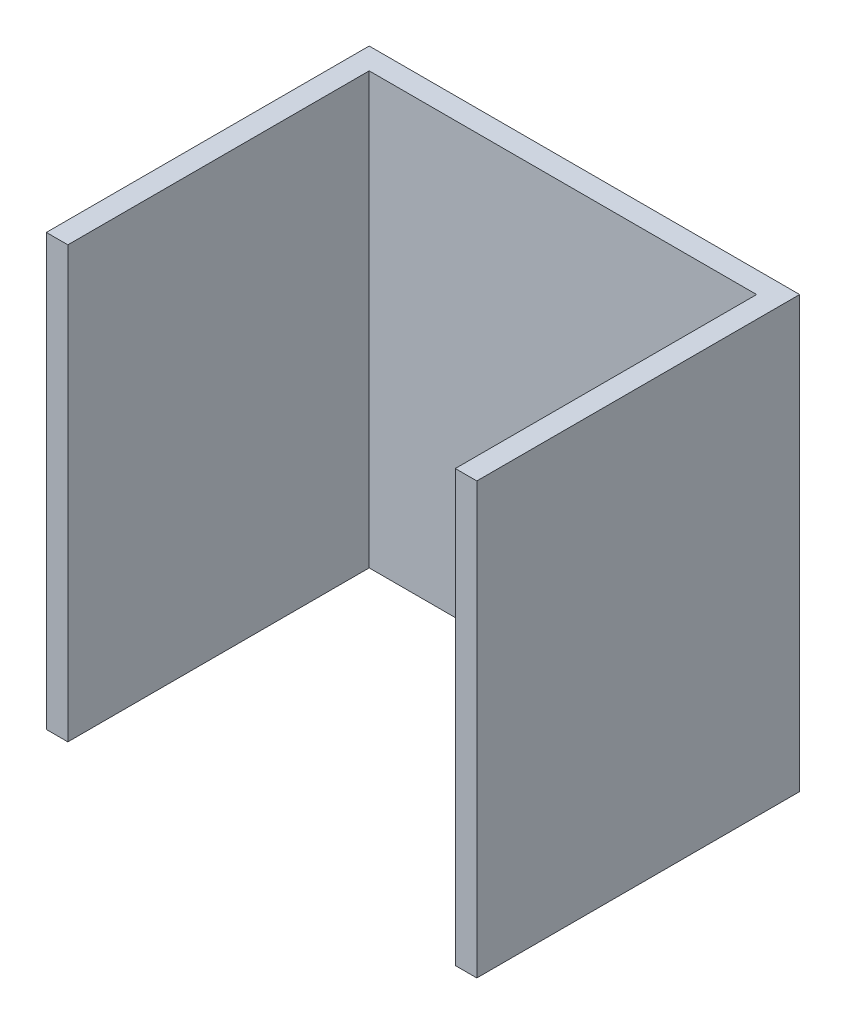
from build123d import *

# Parameters (mm, degrees)
SKETCH1_W           = 100
SKETCH1_H           = 100
BOSS_EXTRUDE1_DEPTH = 5
SKETCH2_W           = 5
SKETCH2_H           = 100
BOSS_EXTRUDE3_DEPTH = 70


with BuildPart() as part:
    # Sketch1 → Boss-Extrude1 (new body)
    with BuildSketch(Plane.XY):
        Rectangle(SKETCH1_W, SKETCH1_H)
    extrude(amount=-BOSS_EXTRUDE1_DEPTH)

    # Sketch2 → Boss-Extrude3 (add)
    with BuildSketch(Plane.XY):
        with Locations((-47.5, 0)):
            Rectangle(SKETCH2_W, SKETCH2_H)
        with Locations((47.5, 0)):
            Rectangle(SKETCH2_W, SKETCH2_H)
    extrude(amount=BOSS_EXTRUDE3_DEPTH)


solid = part.part
